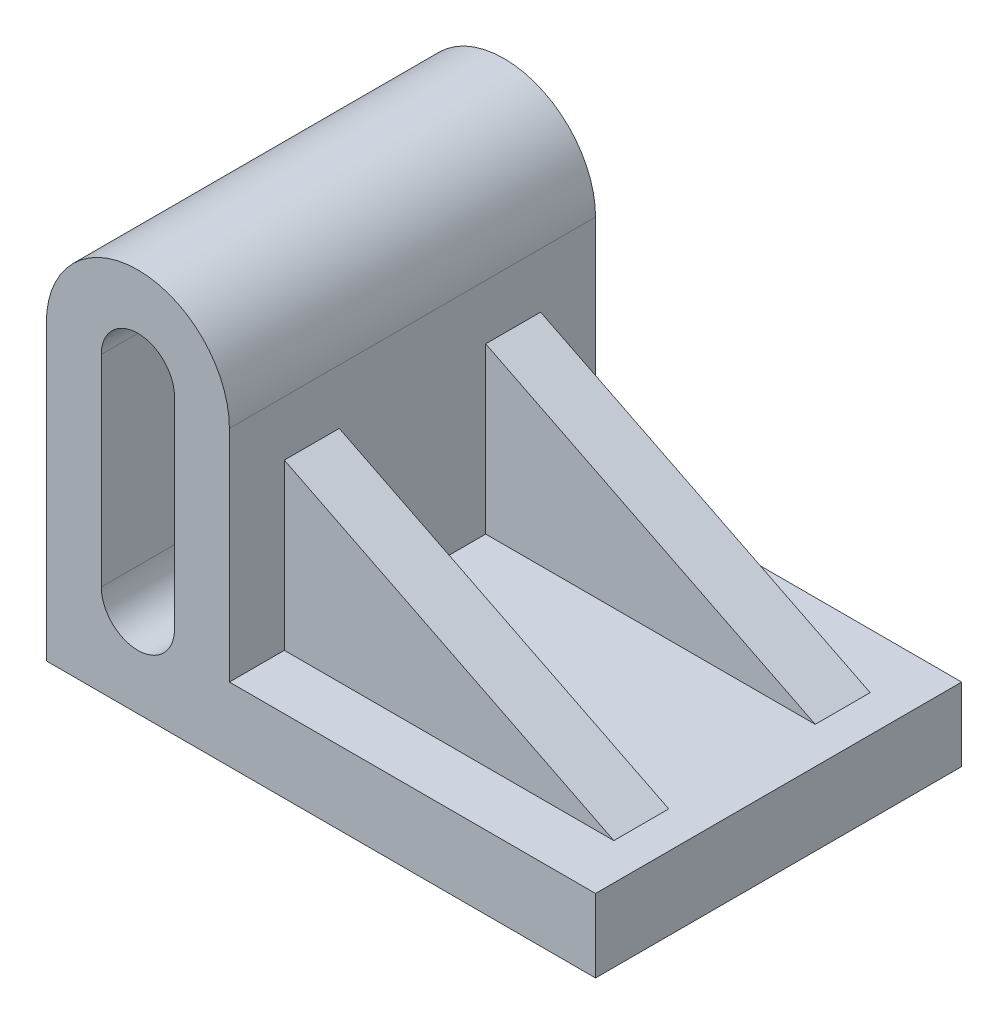
from build123d import *

# Parameters (mm, degrees)
BOSS_EXTRUDE1_DEPTH      = 50
BOSS_EXTRUDE1_DEPTH_BACK = 50
CUT_EXTRUDE1_DEPTH       = 190.802528961
CUT_EXTRUDE1_DEPTH_BACK  = 190.802528961
BOSS_EXTRUDE2_DEPTH      = 35
BOSS_EXTRUDE2_DEPTH_BACK = 35
CUT_EXTRUDE2_DEPTH       = 20
CUT_EXTRUDE2_DEPTH_BACK  = 20


with BuildPart() as part:
    # Sketch1 → Boss-Extrude1 (new, two sides: drawn at the far end of the back side and taken through both)
    with BuildSketch(Plane.XY.offset(-BOSS_EXTRUDE1_DEPTH_BACK)):
        with BuildLine():
            Line((0, 0), (150, 0))
            Line((150, 0), (150, 20))
            Line((150, 20), (50, 20))
            Line((50, 20), (50, 80))
            ThreePointArc((50, 80), (25, 105), (0, 80))
            Line((0, 80), (0, 0))
        make_face()
    extrude(amount=BOSS_EXTRUDE1_DEPTH + BOSS_EXTRUDE1_DEPTH_BACK)

    # Sketch3 → Cut-Extrude1 (cut, two sides: drawn at the far end of the back side and taken through both)
    with BuildSketch(Plane.XY.offset(-CUT_EXTRUDE1_DEPTH_BACK)):
        with BuildLine():
            Line((35, 80), (35, 25))
            ThreePointArc((35, 25), (25, 15), (15, 25))
            Line((15, 25), (15, 80))
            ThreePointArc((15, 80), (25, 90), (35, 80))
        make_face()
    extrude(amount=CUT_EXTRUDE1_DEPTH + CUT_EXTRUDE1_DEPTH_BACK, mode=Mode.SUBTRACT)

    # Sketch4 → Boss-Extrude2 (add, two sides: drawn at the far end of the back side and taken through both)
    with BuildSketch(Plane.XY.offset(-BOSS_EXTRUDE2_DEPTH_BACK)):
        Polygon((50, 65), (50, 20), (140, 20), align=None)
    extrude(amount=BOSS_EXTRUDE2_DEPTH + BOSS_EXTRUDE2_DEPTH_BACK)

    # Sketch5 → Cut-Extrude2 (cut, two sides: drawn at the far end of the back side and taken through both)
    with BuildSketch(Plane.XY.offset(-CUT_EXTRUDE2_DEPTH_BACK)):
        Polygon((50, 65), (50, 20), (140, 20), align=None)
    extrude(amount=CUT_EXTRUDE2_DEPTH + CUT_EXTRUDE2_DEPTH_BACK, mode=Mode.SUBTRACT)


solid = part.part
